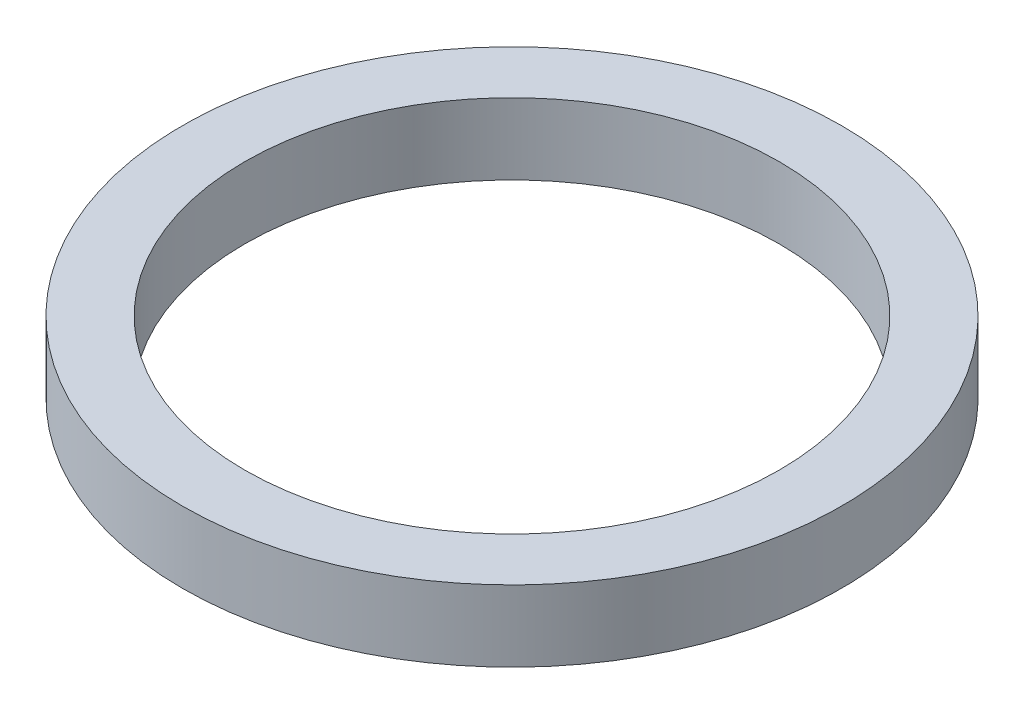
from build123d import *

# Parameters (mm, degrees)
SKETCH_1_R      = 18.5
SKETCH_1_R_2    = 15
EXTRUDE_1_DEPTH = 4


with BuildPart() as part:
    # 草图1 → 凸台-拉伸1 (new body)
    with BuildSketch(Plane(origin=(0, 0, 0), x_dir=(1, 0, 0), z_dir=(0, 1, 0))):
        with Locations(Location((0, 0, 0), (0, 0, 270))):
            Circle(SKETCH_1_R)
        with Locations(Location((0, 0, 0), (0, 0, 270))):
            Circle(SKETCH_1_R_2, mode=Mode.SUBTRACT)
    extrude(amount=EXTRUDE_1_DEPTH)


solid = part.part
